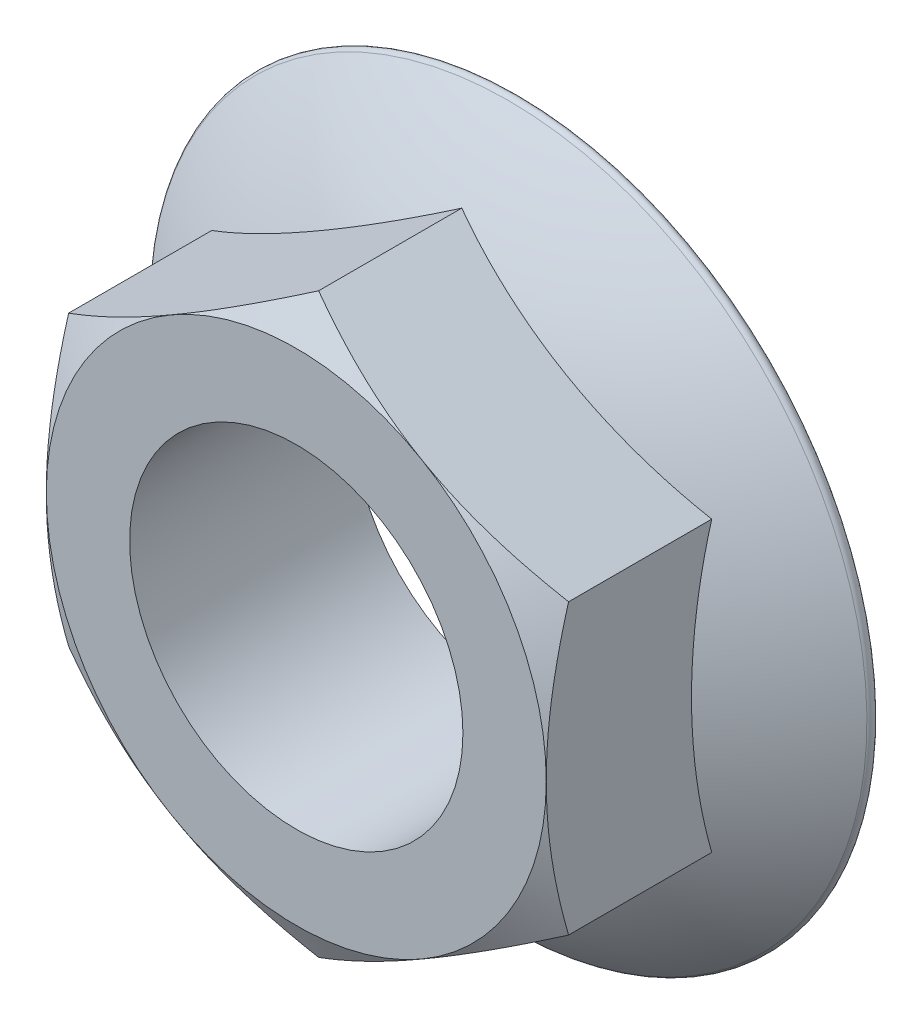
from build123d import *

# Parameters (mm, degrees)
BOSS_EXTRUDE1_DEPTH = 20
SKETCH3_OUTSIDE_W   = 262.564
SKETCH3_OUTSIDE_H   = 262.564
SKETCH3_OUTSIDE_R   = 22.5
CUT_EXTRUDE1_DEPTH  = 51.060014113
CUT_EXTRUDE1_DRAFT  = -60
SKETCH4_R           = 15
CUT_EXTRUDE2_DEPTH  = 51.060014113


with BuildPart() as part:
    # Sketch1 → Boss-Extrude1 (new body)
    with BuildSketch(Plane.XY):
        Polygon((-22.5, 12.990381057), (-22.5, -12.990381057), (0, -25.980762114), (22.5, -12.990381057), (22.5, 12.990381057), (0, 25.980762114), align=None)
    extrude(amount=BOSS_EXTRUDE1_DEPTH)

    # Sketch2 → Revolve1 (revolve)
    with BuildSketch(Plane(origin=(0, 0, 0), x_dir=(0, 0, -1), z_dir=(1, 0, 0)), mode=Mode.PRIVATE) as revolve1_sk:
        with BuildLine():
            Line((0, 0), (-12, 0))
            ThreePointArc((-12, 0), (-9.145772075, -17.058051419), (-0.894027207, -32.257802794))
            ThreePointArc((-0.894027207, -32.257802794), (-0.337232687, -32.42276506), (0, -31.95))
            Line((0, -31.95), (0, 0))
        make_face()
    revolve(revolve1_sk.sketch.rotate(Axis((0, 0, 0), (0, 0, 1)), 180), axis=Axis((0, 0, 0), (0, 0, 1)))


with BuildPart() as cut_extrude1_tool:
    # Sketch3 outside → Cut-Extrude1 (with draft: the straight prism first)
    with BuildSketch(Plane.XY.offset(20)):
        Rectangle(SKETCH3_OUTSIDE_W, SKETCH3_OUTSIDE_H)
        Circle(SKETCH3_OUTSIDE_R, mode=Mode.SUBTRACT)
    extrude(amount=-CUT_EXTRUDE1_DEPTH)
    # Cut-Extrude1: the draft: its side faces are tilted about the plane it starts from
    cut_extrude1_sides = [cut_extrude1_tool.faces().sort_by_distance(p)[0] for p in [
        (0, -131.282, -5.530007056),
        (131.282, 0, -5.530007056),
        (0, 131.282, -5.530007056),
        (-131.282, 0, -5.530007056),
        (-22.5, 0, -5.530007056),
    ]]
    draft(cut_extrude1_sides, Plane.XY.offset(20), CUT_EXTRUDE1_DRAFT)


with BuildPart() as part_1:
    add(part.part)

    # Cut-Extrude1: cut by cut_extrude1_tool
    add(cut_extrude1_tool.part, mode=Mode.SUBTRACT)

    # Sketch4 → Cut-Extrude2 (cut, through all)
    with BuildSketch(Plane.XY.offset(20)):
        Circle(SKETCH4_R)
    extrude(amount=-CUT_EXTRUDE2_DEPTH, mode=Mode.SUBTRACT)


solid = part_1.part
